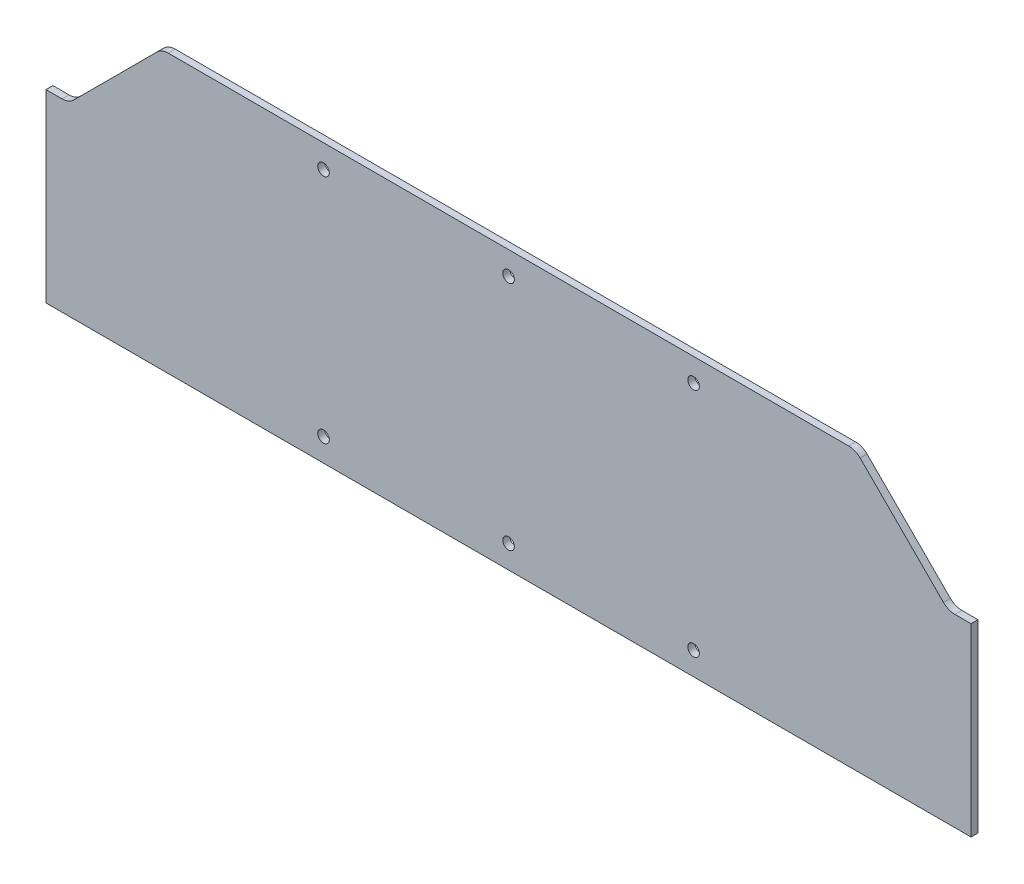
from build123d import *

# Parameters (mm, degrees)
SKETCH1_W           = 400
SKETCH1_H           = 120
BOSS_EXTRUDE1_DEPTH = 3
CUT_EXTRUDE1_REACH  = 210.828
CUT_EXTRUDE2_REACH  = 210.828
SKETCH3_R           = 2.5


with BuildPart() as part:
    # Sketch1 → Boss-Extrude1 (new body)
    with BuildSketch(Plane.XY):
        Rectangle(SKETCH1_W, SKETCH1_H)
    extrude(amount=BOSS_EXTRUDE1_DEPTH)

    # Sketch2 → Cut-Extrude1 (cut, up to next)
    with BuildSketch(Plane(origin=(0, 0, 0), x_dir=(-1, 0, 0), z_dir=(0, 0, -1)), mode=Mode.PRIVATE) as cut_extrude1_sk1:
        with BuildLine():
            Line((200, 60), (147.100505063, 60))
            ThreePointArc((147.100505063, 60), (149.77928909, 59.467156728), (152.050252532, 57.949747468))
            Line((152.050252532, 57.949747468), (188.050252532, 21.949747468))
            ThreePointArc((188.050252532, 21.949747468), (190.321215973, 20.432338209), (193, 19.899494937))
            Line((193, 19.899494937), (200, 19.899494937))
            Line((200, 19.899494937), (200, 60))
        make_face()
    cut_extrude1_tool1 = extrude(cut_extrude1_sk1.sketch, amount=-CUT_EXTRUDE1_REACH, mode=Mode.PRIVATE) & part.part
    # Sketch2 → Cut-Extrude1 (cut, up to next)
    with BuildSketch(Plane(origin=(0, 0, 0), x_dir=(-1, 0, 0), z_dir=(0, 0, -1)), mode=Mode.PRIVATE) as cut_extrude1_sk2:
        with BuildLine():
            Line((-152.050252532, 57.949747468), (-188.050252532, 21.949747468))
            ThreePointArc((-188.050252532, 21.949747468), (-190.321215973, 20.432338209), (-193, 19.899494937))
            Line((-193, 19.899494937), (-200, 19.899494937))
            Line((-200, 19.899494937), (-200, 60))
            Line((-200, 60), (-147.100505063, 60))
            ThreePointArc((-147.100505063, 60), (-149.77928909, 59.467156728), (-152.050252532, 57.949747468))
        make_face()
    cut_extrude1_tool2 = extrude(cut_extrude1_sk2.sketch, amount=-CUT_EXTRUDE1_REACH, mode=Mode.PRIVATE) & part.part
    add(cut_extrude1_tool1.solids().sort_by_distance((-182.75247, 44.458509, 0))[0], mode=Mode.SUBTRACT)
    add(cut_extrude1_tool2.solids().sort_by_distance((182.75247, 44.458509, 0))[0], mode=Mode.SUBTRACT)

    # Sketch3 → Cut-Extrude2 (cut, up to next)
    with BuildSketch(Plane.XY.offset(3), mode=Mode.PRIVATE) as cut_extrude2_sk1:
        with Locations((-80, 50)):
            Circle(SKETCH3_R)
    cut_extrude2_tool1 = extrude(cut_extrude2_sk1.sketch, amount=-CUT_EXTRUDE2_REACH, mode=Mode.PRIVATE) & part.part
    # Sketch3 → Cut-Extrude2 (cut, up to next)
    with BuildSketch(Plane.XY.offset(3), mode=Mode.PRIVATE) as cut_extrude2_sk2:
        with Locations((0, 50)):
            Circle(SKETCH3_R)
    cut_extrude2_tool2 = extrude(cut_extrude2_sk2.sketch, amount=-CUT_EXTRUDE2_REACH, mode=Mode.PRIVATE) & part.part
    # Sketch3 → Cut-Extrude2 (cut, up to next)
    with BuildSketch(Plane.XY.offset(3), mode=Mode.PRIVATE) as cut_extrude2_sk3:
        with Locations((0, -50)):
            Circle(SKETCH3_R)
    cut_extrude2_tool3 = extrude(cut_extrude2_sk3.sketch, amount=-CUT_EXTRUDE2_REACH, mode=Mode.PRIVATE) & part.part
    # Sketch3 → Cut-Extrude2 (cut, up to next)
    with BuildSketch(Plane.XY.offset(3), mode=Mode.PRIVATE) as cut_extrude2_sk4:
        with Locations((-80, -50)):
            Circle(SKETCH3_R)
    cut_extrude2_tool4 = extrude(cut_extrude2_sk4.sketch, amount=-CUT_EXTRUDE2_REACH, mode=Mode.PRIVATE) & part.part
    # Sketch3 → Cut-Extrude2 (cut, up to next)
    with BuildSketch(Plane.XY.offset(3), mode=Mode.PRIVATE) as cut_extrude2_sk5:
        with Locations((80, -50)):
            Circle(SKETCH3_R)
    cut_extrude2_tool5 = extrude(cut_extrude2_sk5.sketch, amount=-CUT_EXTRUDE2_REACH, mode=Mode.PRIVATE) & part.part
    # Sketch3 → Cut-Extrude2 (cut, up to next)
    with BuildSketch(Plane.XY.offset(3), mode=Mode.PRIVATE) as cut_extrude2_sk6:
        with Locations((80, 50)):
            Circle(SKETCH3_R)
    cut_extrude2_tool6 = extrude(cut_extrude2_sk6.sketch, amount=-CUT_EXTRUDE2_REACH, mode=Mode.PRIVATE) & part.part
    add(cut_extrude2_tool1.solids().sort_by_distance((-80, 50, 3))[0], mode=Mode.SUBTRACT)
    add(cut_extrude2_tool2.solids().sort_by_distance((0, 50, 3))[0], mode=Mode.SUBTRACT)
    add(cut_extrude2_tool3.solids().sort_by_distance((0, -50, 3))[0], mode=Mode.SUBTRACT)
    add(cut_extrude2_tool4.solids().sort_by_distance((-80, -50, 3))[0], mode=Mode.SUBTRACT)
    add(cut_extrude2_tool5.solids().sort_by_distance((80, -50, 3))[0], mode=Mode.SUBTRACT)
    add(cut_extrude2_tool6.solids().sort_by_distance((80, 50, 3))[0], mode=Mode.SUBTRACT)


solid = part.part
